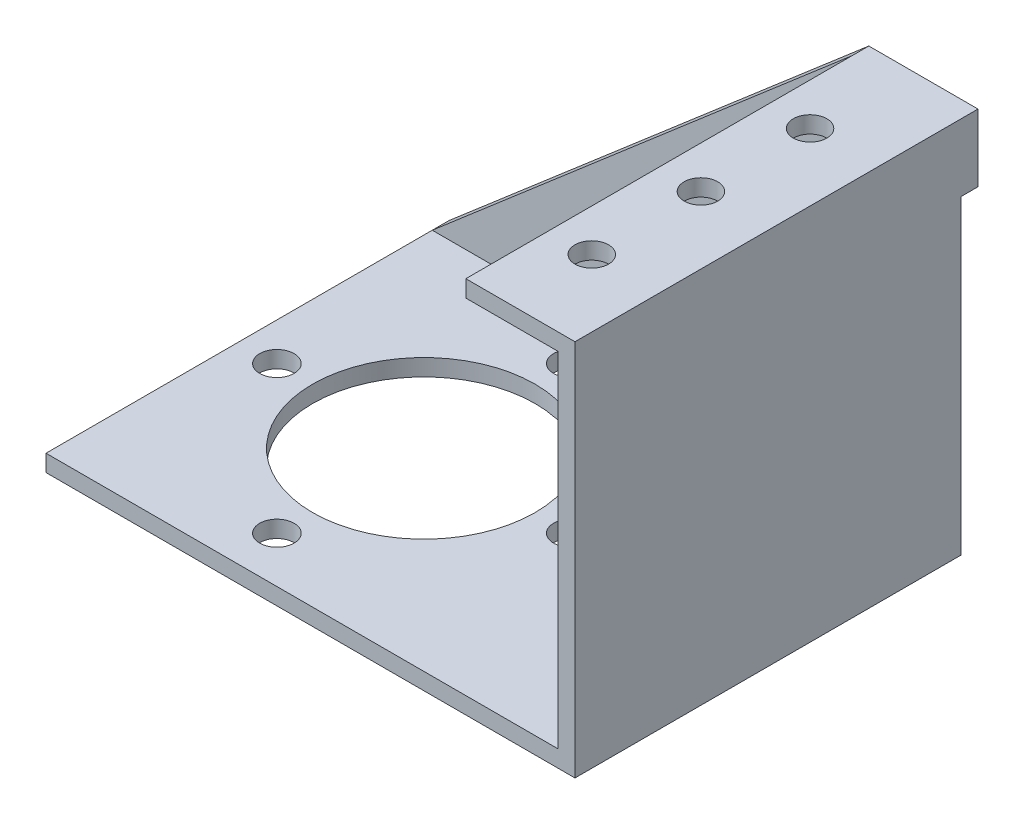
from build123d import *

# Parameters (mm, degrees)
BOSS_EXTRUDE1_DEPTH = 46
SKETCH2_R           = 13.25
SKETCH2_R_2         = 2.05
CUT_EXTRUDE1_DEPTH  = 2
SKETCH3_R           = 2
CUT_EXTRUDE2_DEPTH  = 100
BOSS_EXTRUDE2_DEPTH = 2


with BuildPart() as part:
    # Sketch1 → Boss-Extrude1 (new body)
    with BuildSketch(Plane.XY):
        Polygon((0, 0), (0, 45), (-13, 45), (-13, 43), (-2, 43), (-2, 2), (-63, 2), (-63, 0), align=None)
    extrude(amount=BOSS_EXTRUDE1_DEPTH)

    # Sketch2 → Cut-Extrude1 (cut)
    with BuildSketch(Plane.XZ):
        with Locations(Location((-41, 23, 0), (0, 0, 270))):
            Circle(SKETCH2_R)
        with Locations(Location((-41, 40.5, 0), (0, 0, 270))):
            Circle(SKETCH2_R_2)
        with Locations(Location((-58.5, 23, 0), (0, 0, 270))):
            Circle(SKETCH2_R_2)
        with Locations(Location((-23.5, 23, 0), (0, 0, 270))):
            Circle(SKETCH2_R_2)
        with Locations(Location((-41, 5.5, 0), (0, 0, 270))):
            Circle(SKETCH2_R_2)
    extrude(amount=-CUT_EXTRUDE1_DEPTH, mode=Mode.SUBTRACT)

    # Sketch3 → Cut-Extrude2 (cut)
    with BuildSketch(Plane(origin=(0, 45, 0), x_dir=(1, 0, 0), z_dir=(0, 1, 0))):
        with Locations(Location((-8, -10, 0), (0, 0, 270))):
            Circle(SKETCH3_R)
        with Locations(Location((-8, -23, 0), (0, 0, 270))):
            Circle(SKETCH3_R)
        with Locations(Location((-8, -36, 0), (0, 0, 270))):
            Circle(SKETCH3_R)
    extrude(amount=-CUT_EXTRUDE2_DEPTH, mode=Mode.SUBTRACT)

    # Sketch4 → Boss-Extrude2 (add)
    with BuildSketch(Plane(origin=(0, 0, 0), x_dir=(-1, 0, 0), z_dir=(0, 0, -1))):
        Polygon((13, 45), (63, 2), (63, 0), (43, 0), (0, 36.98), (0, 45), align=None)
    extrude(amount=BOSS_EXTRUDE2_DEPTH)


solid = part.part
